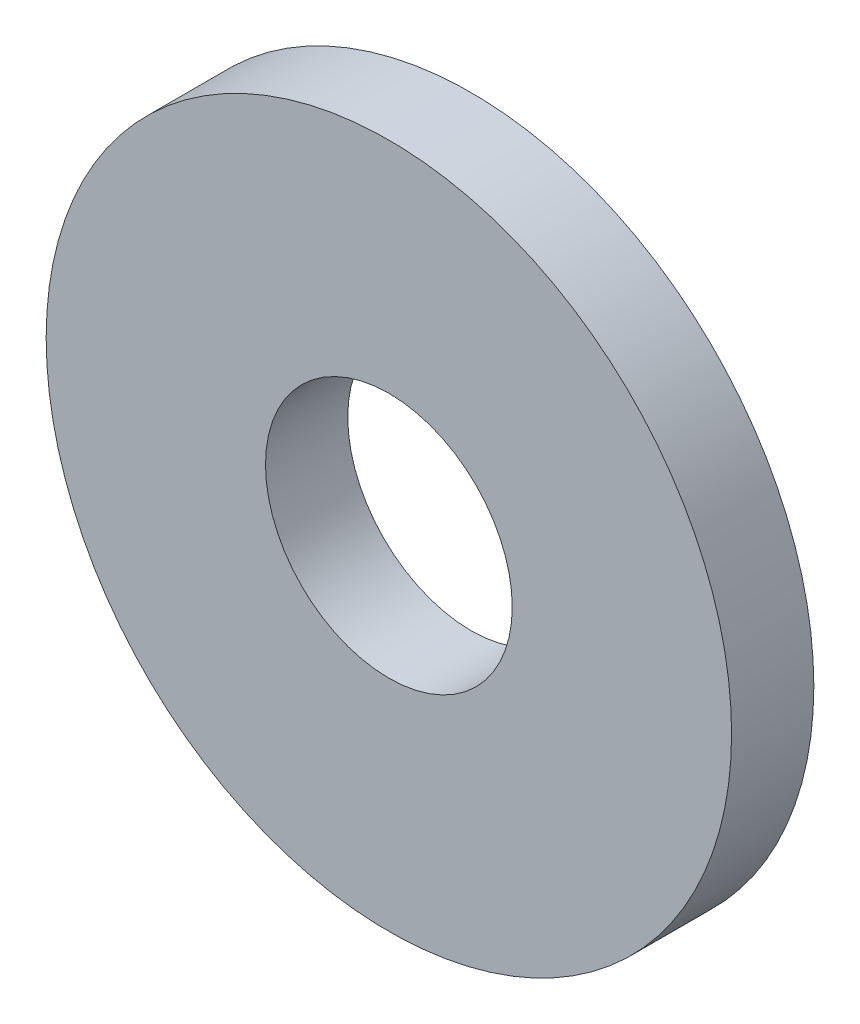
from build123d import *

# Parameters (mm, degrees)
SKETCH1_R           = 5
SKETCH1_R_2         = 1.8
BOSS_EXTRUDE1_DEPTH = 1.2


with BuildPart() as part:
    # Sketch1 → Boss-Extrude1 (new body)
    with BuildSketch(Plane.XY):
        Circle(SKETCH1_R)
        Circle(SKETCH1_R_2, mode=Mode.SUBTRACT)
    extrude(amount=BOSS_EXTRUDE1_DEPTH)


solid = part.part
